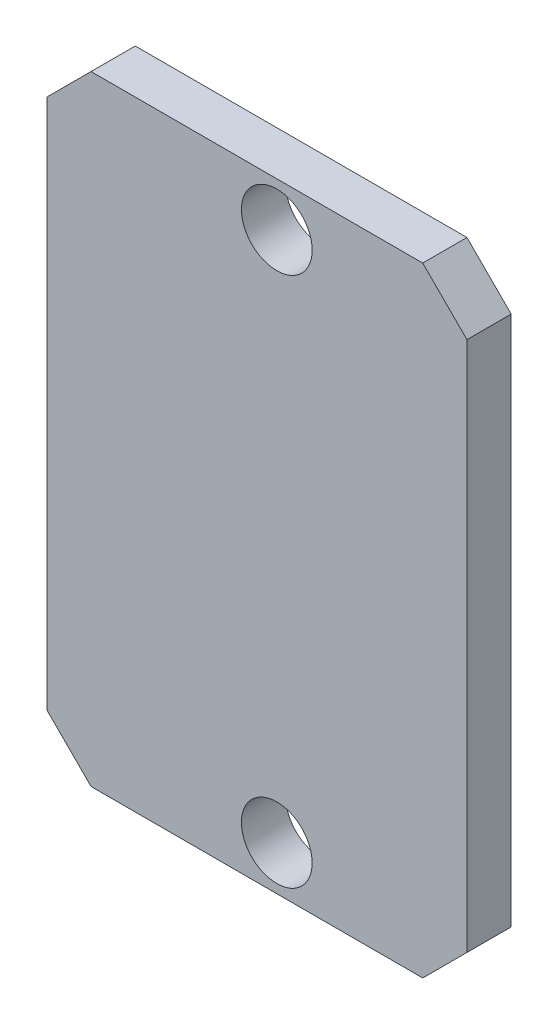
from build123d import *

# Parameters (mm, degrees)
SKETCH2_R           = 1.6
BOSS_EXTRUDE1_DEPTH = 2


with BuildPart() as part:
    # Sketch2 → Boss-Extrude1 (new body)
    with BuildSketch(Plane.XY):
        Polygon((2, 0), (17, 0), (19, 2), (19, 26), (17, 28), (2, 28), (0, 26), (0, 2), align=None)
        with Locations((10.4, 26)):
            Circle(SKETCH2_R, mode=Mode.SUBTRACT)
        with Locations(Location((10.4, 2, 0), (0, 0, 180))):
            Circle(SKETCH2_R, mode=Mode.SUBTRACT)
    extrude(amount=BOSS_EXTRUDE1_DEPTH)


solid = part.part
